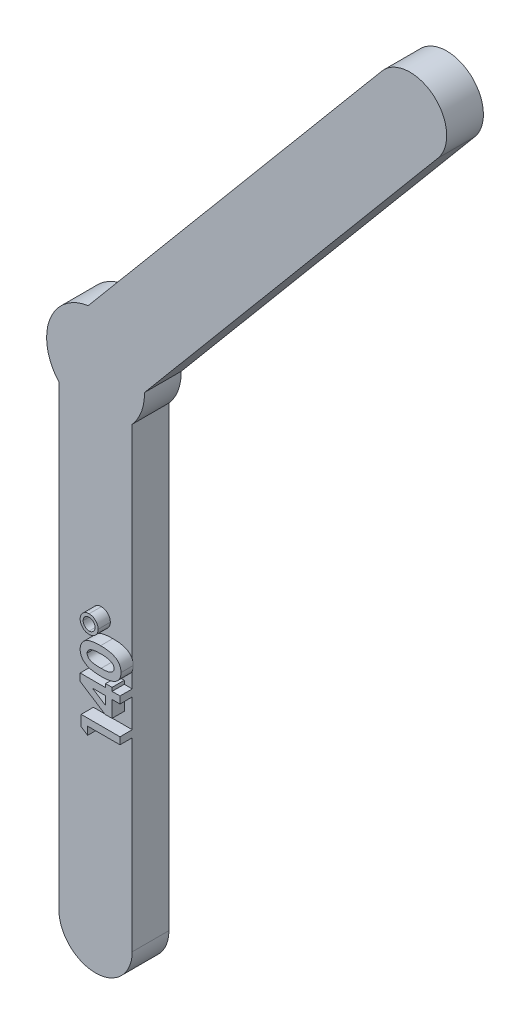
from build123d import *

# Parameters (mm, degrees)
BOSS_EXTRUDE1_DEPTH = 3
BOSS_EXTRUDE2_DEPTH = 1


with BuildPart() as part:
    # Sketch2 → Boss-Extrude1 (new body)
    with BuildSketch(Plane.XY):
        with BuildLine():
            Line((-3, -40), (-3, -2.645751311))
            ThreePointArc((-3, -2.645751311), (-3.758770483, 1.368080573), (-0.597477168, 3.955125919))
            Line((-0.597477168, 3.955125919), (23.413371058, 32.570140554))
            ThreePointArc((23.413371058, 32.570140554), (27.639867217, 32.939911054), (28.009637717, 28.713414896))
            Line((28.009637717, 28.713414896), (3.99878949, 0.098400261))
            ThreePointArc((3.99878949, 0.098400261), (3.758770483, -1.368080573), (3, -2.645751311))
            Line((3, -2.645751311), (3, -40))
            ThreePointArc((3, -40), (0, -43), (-3, -40))
        make_face()
    extrude(amount=BOSS_EXTRUDE1_DEPTH)

    # Sketch3 → Boss-Extrude2 (add)
    # profile 1 of 4: a face of its own
    with BuildSketch(Plane.XY.offset(3)):
        Polygon((-0.175, -25.154881865), (-0.175, -24.27399745), (3, -24.27399745), (3, -24.843869245), (0.354166667, -24.843869245), (0.354166667, -25.495151297), align=None)
    # profile 2 of 4: a face of its own
    with BuildSketch(Plane.XY.offset(3)):
        Polygon((-0.256410256, -21.977973813), (-0.256410256, -21.383933348), (1.819551282, -21.383933348), (1.819551282, -21.09899745), (2.348717949, -21.09899745), (2.348717949, -21.383933348), (3, -21.383933348), (3, -21.953805143), (2.348717949, -21.953805143), (2.348717949, -23.297074373), (1.77184996, -23.297074373), align=None)
        Polygon((1.819551282, -21.953805143), (0.738957332, -21.953805143), (1.819551282, -22.656604622), align=None, mode=Mode.SUBTRACT)
    # profile 3 of 4: a face of its own
    with BuildSketch(Plane.XY.offset(3)):
        with BuildLine():
            add(Edge.make_bspline(
                [(-0.256410256, -19.704210792), (-0.256000846, -19.676626588), (-0.255195836, -19.622388674), (-0.246473924, -19.542507179), (-0.233303758, -19.465556362), (-0.214913964, -19.391248475), (-0.19065475, -19.320070091), (-0.161374324, -19.251772208), (-0.126796317, -19.186416442), (-0.086761751, -19.123933567), (-0.040652473, -19.064881676), (0.010185802, -19.008305986), (0.067717809, -18.956474939), (0.130454644, -18.907822351), (0.198771401, -18.862680502), (0.272469109, -18.82075786), (0.352002612, -18.78247233), (0.437488797, -18.747367278), (0.530216664, -18.715977837), (0.631247648, -18.6895381), (0.740605462, -18.666861737), (0.858562124, -18.647721246), (0.985274483, -18.63325414), (1.120658341, -18.623503016), (1.264452704, -18.616811334), (1.363094454, -18.616265206), (1.413772035, -18.61598463)],
                knots=[0, 0, 0, 0, 0.879187688, 1.728717895, 2.558878706, 3.367146394, 4.166631857, 4.95393622, 5.734098362, 6.521634849, 7.316678452, 8.120609651, 8.943639266, 9.781961388, 10.650008082, 11.55217958, 12.483362701, 13.462505087, 14.497127373, 15.602264045, 16.790140859, 18.057036744, 19.411188506, 20.855078804, 22.384284574, 24, 24, 24, 24], degree=3))
            add(Edge.make_bspline(
                [(1.413772035, -18.61598463), (1.465083636, -18.616287906), (1.564781155, -18.616877167), (1.709890925, -18.623224306), (1.846257088, -18.634157921), (1.973869318, -18.648238838), (2.09264741, -18.66756409), (2.202741653, -18.690031741), (2.304172829, -18.717129564), (2.396949232, -18.749371918), (2.482667702, -18.784531009), (2.562361603, -18.822312059), (2.635439661, -18.864353491), (2.704216337, -18.906823768), (2.765684896, -18.954461824), (2.822263901, -19.003740164), (2.87178804, -19.057163186), (2.916848745, -19.112418964), (2.955788395, -19.171548047), (2.989844864, -19.233936425), (3.017468579, -19.300697505), (3.041494248, -19.37061404), (3.058742076, -19.444877857), (3.072427664, -19.522308891), (3.079991159, -19.603781328), (3.080929461, -19.659251045), (3.081410256, -19.687674333)],
                knots=[0, 0, 0, 0, 1.643824397, 3.193921316, 4.652018541, 6.026147715, 7.305813021, 8.506024873, 9.624771103, 10.66654028, 11.650369642, 12.592128821, 13.489360096, 14.35046321, 15.179132238, 15.977837183, 16.751455772, 17.509897991, 18.259653136, 19.016390304, 19.783391144, 20.571659993, 21.382176161, 22.223003704, 23.089447706, 24, 24, 24, 24], degree=3))
            add(Edge.make_bspline(
                [(3.081410256, -19.687674333), (3.080920089, -19.716096803), (3.079959859, -19.771776003), (3.072484978, -19.853469471), (3.058682809, -19.931308258), (3.041375575, -20.00616891), (3.017471846, -20.077475639), (2.989215292, -20.145861446), (2.954465748, -20.209974058), (2.915602853, -20.271134519), (2.870815661, -20.32837689), (2.820807888, -20.382549716), (2.766280514, -20.434410771), (2.705338818, -20.48211241), (2.639096011, -20.526507807), (2.567561271, -20.568068111), (2.490500768, -20.605949144), (2.40793533, -20.64141777), (2.317883816, -20.672797661), (2.21949947, -20.699856752), (2.112045503, -20.722776019), (1.995629446, -20.740789452), (1.870235813, -20.755315682), (1.735965212, -20.76608805), (1.592768059, -20.772473876), (1.494340976, -20.773056471), (1.443664864, -20.773356425)],
                knots=[0, 0, 0, 0, 0.917318694, 1.797013832, 2.644089644, 3.467281984, 4.274391433, 5.068665368, 5.852346333, 6.624865025, 7.405043053, 8.194438745, 9.002823433, 9.831034161, 10.688848002, 11.574933485, 12.499091769, 13.45866927, 14.473616003, 15.574277631, 16.749933499, 18.017757418, 19.374908438, 20.82337846, 22.364486432, 24, 24, 24, 24], degree=3))
            add(Edge.make_bspline(
                [(1.443664864, -20.773356425), (1.373254462, -20.772812722), (1.237396686, -20.771763639), (1.0411217, -20.758468898), (0.859699474, -20.73895559), (0.693433485, -20.710295162), (0.541707931, -20.67485694), (0.405522301, -20.629476451), (0.282992161, -20.577814065), (0.210404568, -20.533791075), (0.175445713, -20.512589197)],
                knots=[0, 0, 0, 0, 1.288568992, 2.486310467, 3.599230591, 4.627010532, 5.572937695, 6.447898582, 7.252493626, 8, 8, 8, 8], degree=3))
            add(Edge.make_bspline(
                [(0.175445713, -20.512589197), (0.141102145, -20.487936663), (0.073953702, -20.439736101), (-0.014199652, -20.355456071), (-0.089592717, -20.264908152), (-0.150519281, -20.166232541), (-0.198565973, -20.060989834), (-0.232500812, -19.948276469), (-0.252272829, -19.828508677), (-0.255010519, -19.746262137), (-0.256410256, -19.704210792)],
                knots=[0, 0, 0, 0, 1.058512271, 2.069600068, 3.047294572, 4.004278952, 4.967380941, 5.939006123, 6.946246673, 8, 8, 8, 8], degree=3))
        make_face()
        with BuildLine():
            add(Edge.make_bspline(
                [(0.313461538, -19.690218404), (0.314647089, -19.715152157), (0.316971398, -19.764035548), (0.336589396, -19.835011595), (0.367119772, -19.901650312), (0.402937146, -19.952902882), (0.437997174, -19.990830254), (0.469692245, -20.01745396), (0.505088209, -20.043117515), (0.5457633, -20.065757807), (0.590374583, -20.087353774), (0.639050565, -20.107806606), (0.692584041, -20.12539334), (0.750614615, -20.142166644), (0.814547313, -20.156673417), (0.884999784, -20.169366759), (0.962212565, -20.180180249), (1.046509296, -20.187979133), (1.137448259, -20.195139911), (1.235421604, -20.200295911), (1.340408748, -20.202446748), (1.412711585, -20.203131334), (1.45002504, -20.20348463)],
                knots=[0, 0, 0, 0, 1.076486532, 2.110485037, 3.16053299, 4.233735637, 4.798028448, 5.389657808, 6.0205397, 6.6857231, 7.399126456, 8.163539924, 8.966557062, 9.834164971, 10.774831688, 11.799768806, 12.928987201, 14.14492726, 15.459726247, 16.873396567, 18.386448164, 20, 20, 20, 20], degree=3))
            add(Edge.make_bspline(
                [(1.45002504, -20.20348463), (1.498366186, -20.202901703), (1.591063917, -20.201783897), (1.72437073, -20.195968317), (1.845884837, -20.184173567), (1.956076433, -20.169847452), (2.054303096, -20.149158475), (2.141437387, -20.125745468), (2.216697621, -20.096689647), (2.280987028, -20.063126334), (2.335677326, -20.025949898), (2.382164459, -19.985594062), (2.42242009, -19.943431849), (2.455119251, -19.898147472), (2.480178379, -19.849848909), (2.498203101, -19.798939379), (2.509236783, -19.745386525), (2.5107668, -19.708714083), (2.511538462, -19.690218404)],
                knots=[0, 0, 0, 0, 1.771738815, 3.39744054, 4.888007323, 6.245018868, 7.467093912, 8.564230264, 9.548241846, 10.417081984, 11.216594933, 11.965786359, 12.669352538, 13.348558586, 14.005353126, 14.656563323, 15.322440191, 16, 16, 16, 16], degree=3))
            add(Edge.make_bspline(
                [(2.511538462, -19.690218404), (2.511010434, -19.672357438), (2.50997662, -19.637387889), (2.499364668, -19.586394454), (2.482111937, -19.538171438), (2.457706739, -19.492864442), (2.426671795, -19.450311409), (2.388870725, -19.410720312), (2.34392674, -19.374389739), (2.310571656, -19.353223383), (2.293384415, -19.342316761)],
                knots=[0, 0, 0, 0, 0.992283464, 1.942767638, 2.88273346, 3.832339453, 4.79467288, 5.803907806, 6.868395428, 8, 8, 8, 8], degree=3))
            add(Edge.make_bspline(
                [(2.293384415, -19.342316761), (2.2698986, -19.329476052), (2.22065075, -19.302550125), (2.137546839, -19.271391395), (2.043819364, -19.245163714), (1.939176634, -19.222589932), (1.823205926, -19.207150842), (1.69664262, -19.193854716), (1.558849395, -19.187441665), (1.463385752, -19.186398547), (1.413772035, -19.185856425)],
                knots=[0, 0, 0, 0, 0.710965849, 1.490837728, 2.352621235, 3.297892224, 4.334225155, 5.461620853, 6.680770821, 8, 8, 8, 8], degree=3))
            add(Edge.make_bspline(
                [(1.413772035, -19.185856425), (1.363727648, -19.186065835), (1.267400744, -19.186468913), (1.129112143, -19.193864239), (1.002808457, -19.204162794), (0.88877167, -19.219226607), (0.786724952, -19.238608941), (0.696674974, -19.262497741), (0.618444263, -19.290660859), (0.552110828, -19.324058961), (0.495736507, -19.361049433), (0.447371712, -19.400315949), (0.406079071, -19.442024543), (0.371703192, -19.486105464), (0.345437441, -19.533578982), (0.326891649, -19.58353829), (0.315672066, -19.636085808), (0.314208327, -19.671930654), (0.313461538, -19.690218404)],
                knots=[0, 0, 0, 0, 1.793836731, 3.452829483, 4.963243077, 6.335886805, 7.574563692, 8.684454726, 9.672768357, 10.54971625, 11.340229787, 12.085688095, 12.778991901, 13.440269426, 14.083255152, 14.715733572, 15.344777694, 16, 16, 16, 16], degree=3))
        make_face(mode=Mode.SUBTRACT)
    # profile 4 of 4: a face of its own
    with BuildSketch(Plane.XY.offset(3)):
        with BuildLine():
            add(Edge.make_bspline(
                [(0.476282051, -16.824958989), (0.501543872, -16.825505484), (0.55122174, -16.826580176), (0.624352745, -16.837013476), (0.694208258, -16.854492691), (0.761803607, -16.876903338), (0.825395964, -16.908042089), (0.886396731, -16.944903837), (0.943669883, -16.989402672), (0.9978957, -17.039014969), (1.047295391, -17.093515132), (1.090947065, -17.151405488), (1.127096601, -17.212864468), (1.157366856, -17.276577248), (1.180332148, -17.343408663), (1.196689885, -17.412864586), (1.20741609, -17.485236986), (1.208449037, -17.534503871), (1.208974359, -17.559559349)],
                knots=[0, 0, 0, 0, 1.048753193, 2.062393874, 3.059725798, 4.03711221, 5.013824111, 5.993903926, 6.992478922, 8.020738441, 9.043061753, 10.043343452, 11.026424807, 11.999358773, 12.968420071, 13.955122655, 14.960044262, 16, 16, 16, 16], degree=3))
            add(Edge.make_bspline(
                [(1.208974359, -17.559559349), (1.208454225, -17.584616682), (1.207431478, -17.633887214), (1.196631189, -17.706233128), (1.180530583, -17.775855144), (1.156529218, -17.842391691), (1.126678292, -17.90615653), (1.090260147, -17.967072817), (1.046482503, -18.024600993), (0.996781055, -18.078582797), (0.942375086, -18.128107638), (0.88420218, -18.171482912), (0.823225465, -18.208946116), (0.758107997, -18.237837437), (0.69067286, -18.261947038), (0.619758864, -18.27798784), (0.545943315, -18.288833106), (0.495615647, -18.289833085), (0.469921875, -18.290343604)],
                knots=[0, 0, 0, 0, 1.037227242, 2.039512271, 3.023626077, 3.993053151, 4.963434463, 5.936395473, 6.927031705, 7.952593414, 8.972234493, 9.969891786, 10.954906455, 11.929570282, 12.915563215, 13.916770353, 14.936449251, 16, 16, 16, 16], degree=3))
            add(Edge.make_bspline(
                [(0.469921875, -18.290343604), (0.445290866, -18.289811451), (0.396869022, -18.288765297), (0.325492116, -18.278103661), (0.256787066, -18.261182775), (0.190979117, -18.23681523), (0.128167681, -18.205730248), (0.067236284, -18.169180135), (0.010175979, -18.123937412), (-0.044275745, -18.073515722), (-0.093962638, -18.018218509), (-0.137555056, -17.95952238), (-0.173973759, -17.89802202), (-0.203993097, -17.834134423), (-0.227847104, -17.767768562), (-0.244158222, -17.698411219), (-0.254789074, -17.626671533), (-0.255866772, -17.577830012), (-0.256410256, -17.553199173)],
                knots=[0, 0, 0, 0, 1.027628768, 2.020204677, 3.0054932, 3.977172113, 4.942988595, 5.928118098, 6.937247537, 7.976812879, 9.023474825, 10.036014018, 11.024160528, 12.002107364, 12.979092523, 13.962271943, 14.972371232, 16, 16, 16, 16], degree=3))
            add(Edge.make_bspline(
                [(-0.256410256, -17.553199173), (-0.255881051, -17.528566172), (-0.254836181, -17.479930408), (-0.244068832, -17.408427146), (-0.227959354, -17.339440503), (-0.203981879, -17.27352423), (-0.173948227, -17.210285117), (-0.137706982, -17.149501332), (-0.093944483, -17.091941849), (-0.043999627, -17.038019265), (0.009956511, -16.987787182), (0.068273488, -16.944627592), (0.128824771, -16.907104674), (0.192846684, -16.877455064), (0.259342082, -16.853394895), (0.329176204, -16.837233977), (0.401748506, -16.826543556), (0.451226198, -16.825491671), (0.476282051, -16.824958989)],
                knots=[0, 0, 0, 0, 1.02774298, 2.029191086, 3.012479778, 3.981238486, 4.951290381, 5.931946007, 6.930416638, 7.964088953, 8.997761269, 10.003308488, 10.98854748, 11.966603007, 12.943696749, 13.935593372, 14.954569896, 16, 16, 16, 16], degree=3))
        make_face()
        with BuildLine():
            add(Edge.make_bspline(
                [(0.479462139, -17.069189758), (0.462471258, -17.069424264), (0.428972226, -17.069886612), (0.379883793, -17.077505977), (0.332524379, -17.088023775), (0.287283463, -17.10328392), (0.24427911, -17.123234284), (0.203398935, -17.147571829), (0.164484674, -17.176174899), (0.128492582, -17.209237523), (0.095853701, -17.245103846), (0.066652511, -17.282897251), (0.042455186, -17.323086522), (0.023016589, -17.365273093), (0.006315159, -17.408801858), (-0.003707976, -17.454711924), (-0.01154919, -17.502263298), (-0.011966436, -17.534718897), (-0.012179487, -17.55129112)],
                knots=[0, 0, 0, 0, 1.061159961, 2.092171217, 3.098605391, 4.092036902, 5.070589041, 6.057187883, 7.061962211, 8.084674938, 9.107387665, 10.090954379, 11.06617917, 12.032717429, 12.99305519, 13.973669989, 14.965331307, 16, 16, 16, 16], degree=3))
            add(Edge.make_bspline(
                [(-0.012179487, -17.55129112), (-0.01157068, -17.568051412), (-0.01036426, -17.601263796), (-0.004409395, -17.650200831), (0.007572839, -17.69685371), (0.022606002, -17.742054962), (0.043122897, -17.784898142), (0.067542797, -17.826391236), (0.096744971, -17.865435361), (0.129769422, -17.902214665), (0.165718261, -17.935960463), (0.204573602, -17.964950546), (0.244977971, -17.990352408), (0.287582445, -18.010455361), (0.331832846, -18.026567734), (0.377821945, -18.038209426), (0.425871214, -18.044356322), (0.458458137, -18.045521173), (0.475010016, -18.046112835)],
                knots=[0, 0, 0, 0, 1.042034071, 2.064906527, 3.055369705, 4.030203466, 5.020228521, 6.000742353, 7.017744738, 8.043920206, 9.069249762, 10.075703201, 11.051782302, 12.029903876, 12.99669358, 13.974371501, 14.971122288, 16, 16, 16, 16], degree=3))
            add(Edge.make_bspline(
                [(0.475010016, -18.046112835), (0.491349767, -18.045520146), (0.523514051, -18.044353455), (0.570936909, -18.038223162), (0.616468237, -18.026465839), (0.660506807, -18.010425399), (0.703332854, -17.990458383), (0.743356347, -17.964229259), (0.782721478, -17.935019181), (0.819574977, -17.900938323), (0.853594861, -17.864058718), (0.883277913, -17.824563201), (0.908722399, -17.783622403), (0.929101491, -17.740636346), (0.945194342, -17.696373754), (0.956841315, -17.650387952), (0.962986781, -17.60233779), (0.964151827, -17.56975099), (0.96474359, -17.553199173)],
                knots=[0, 0, 0, 0, 1.017878107, 2.003660885, 2.970612419, 3.939454555, 4.919652619, 5.904816436, 6.913406512, 7.969270601, 9.02513469, 10.033724766, 11.041277553, 12.021475617, 12.990317753, 13.970071221, 14.968938047, 16, 16, 16, 16], degree=3))
            add(Edge.make_bspline(
                [(0.96474359, -17.553199173), (0.964515736, -17.536840687), (0.964066668, -17.504600367), (0.956359019, -17.457448889), (0.946146284, -17.411789288), (0.929505189, -17.368485652), (0.910263551, -17.326033898), (0.884925795, -17.286252494), (0.856415485, -17.247396305), (0.822504018, -17.212069657), (0.787116244, -17.177952839), (0.747777121, -17.149765554), (0.707718654, -17.124520148), (0.665616684, -17.10387006), (0.621397497, -17.089062601), (0.575848465, -17.07693948), (0.528165265, -17.071009446), (0.49579822, -17.069800121), (0.479462139, -17.069189758)],
                knots=[0, 0, 0, 0, 1.029744634, 2.029484694, 3.00508751, 3.97324883, 4.947661161, 5.937798898, 6.940036528, 7.980134083, 9.020231638, 10.033191535, 11.023329272, 12.003497406, 12.979740652, 13.958541426, 14.969648588, 16, 16, 16, 16], degree=3))
        make_face(mode=Mode.SUBTRACT)
    extrude(amount=BOSS_EXTRUDE2_DEPTH)


solid = part.part
